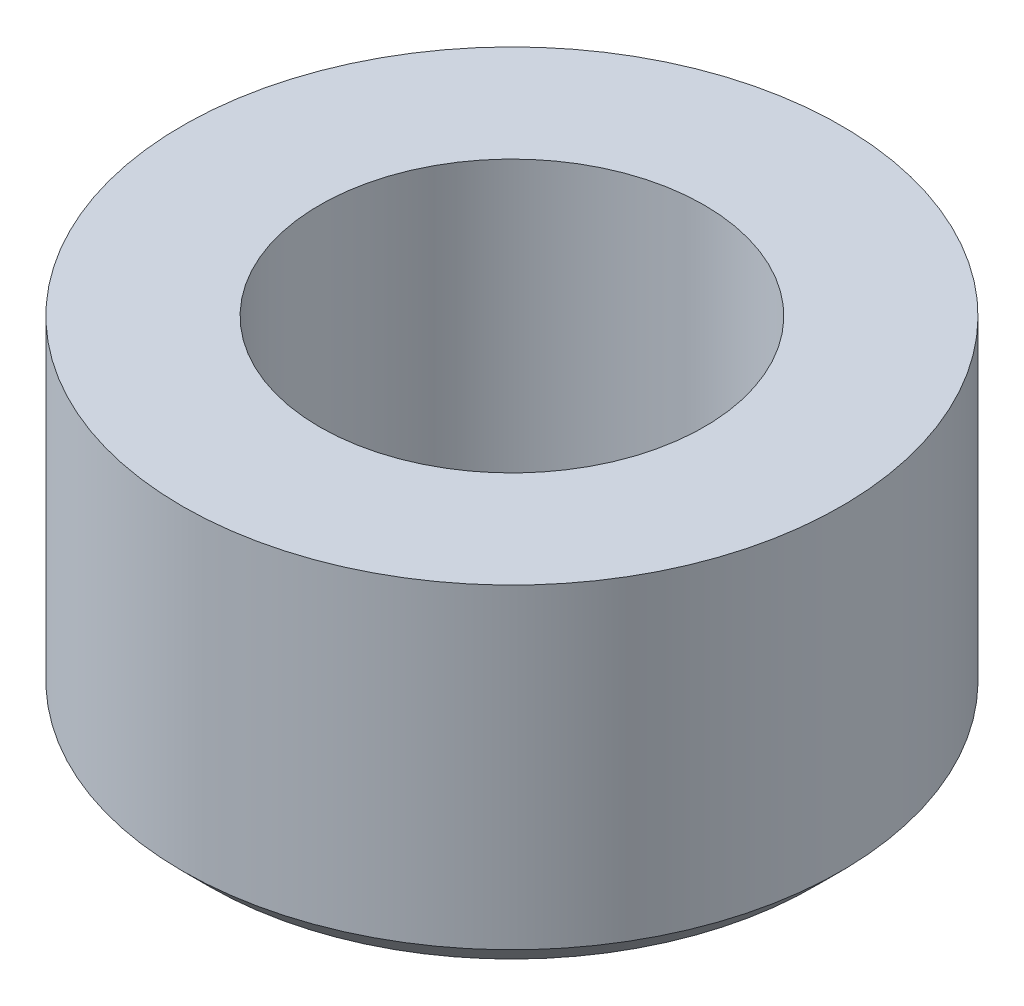
from build123d import *

# Parameters (mm, degrees)
SKETCH1_R           = 6.096
SKETCH1_R_2         = 3.556
BOSS_EXTRUDE1_DEPTH = 6.35
CHAMFER1_SIZE       = 0.508


with BuildPart() as part:
    # Sketch1 → Boss-Extrude1 (new body)
    with BuildSketch(Plane(origin=(0, 0, 0), x_dir=(1, 0, 0), z_dir=(0, 1, 0))):
        with Locations(Location((0, 0, 0), (0, 0, 270))):
            Circle(SKETCH1_R)
        with Locations(Location((0, 0, 0), (0, 0, 270))):
            Circle(SKETCH1_R_2, mode=Mode.SUBTRACT)
    extrude(amount=BOSS_EXTRUDE1_DEPTH)

    # Chamfer1
    chamfer1_edges = [part.edges().sort_by_distance(p)[0] for p in [
        (0, 0, -6.096),
    ]]
    chamfer(chamfer1_edges, length=CHAMFER1_SIZE)


solid = part.part
